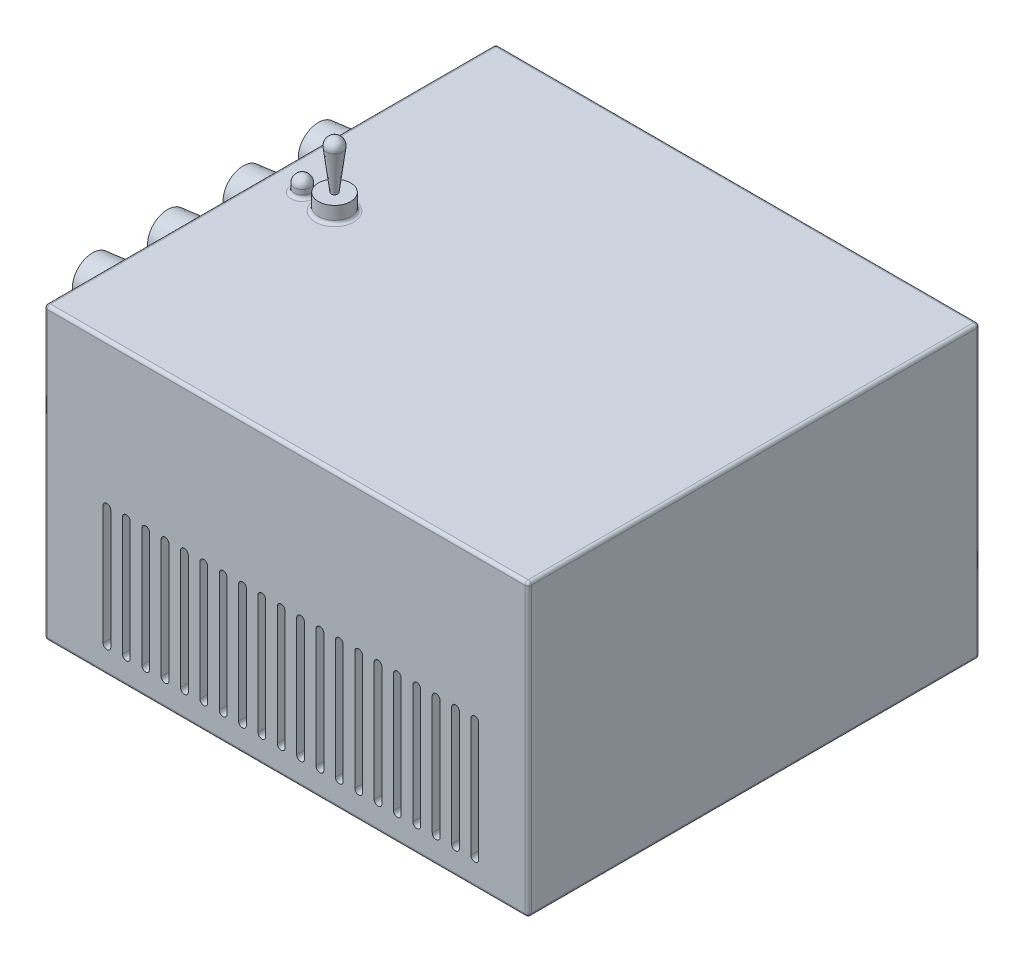
from build123d import *
from OCP.BRepFilletAPI import BRepFilletAPI_MakeChamfer

# Parameters (mm, degrees)
SKETCH1_W           = 150
SKETCH1_H           = 90
BOSS_EXTRUDE1_DEPTH = 140
SKETCH2_R           = 7.5
BOSS_EXTRUDE2_DEPTH = 20
CHAMFER1_SIZE       = 12
CHAMFER1_SIZE2      = 1.261250823
SKETCH3_R           = 4
CUT_EXTRUDE1_DEPTH  = 20
SKETCH4_R           = 2.5
BOSS_EXTRUDE3_DEPTH = 5
FILLET4_R           = 2.5
SKETCH5_R           = 5
BOSS_EXTRUDE4_DEPTH = 5
FILLET5_R           = 1
CUT_EXTRUDE2_DEPTH  = 182.245689604


with BuildPart() as part:
    # Sketch1 → Boss-Extrude1 (new body)
    with BuildSketch(Plane.XY):
        Rectangle(SKETCH1_W, SKETCH1_H)
    extrude(amount=BOSS_EXTRUDE1_DEPTH)

    # Sketch2 → Boss-Extrude2 (add)
    with BuildSketch(Plane.ZY.offset(75)):
        with Locations(Location((35, 25, 0), (0, 0, 180))):
            Circle(SKETCH2_R)
        with Locations(Location((105, 25, 0), (0, 0, 180))):
            Circle(SKETCH2_R)
        with Locations(Location((58.3, 25, 0), (0, 0, 180))):
            Circle(SKETCH2_R)
        with Locations(Location((81.7, 25, 0), (0, 0, 180))):
            Circle(SKETCH2_R)
    extrude(amount=BOSS_EXTRUDE2_DEPTH)

    # Chamfer1: one chamfer whose edges measure the first distance from different faces: ONE call of the kernel's chamfer builder (chamfer() names one face for all edges)
    chamfer1_edges_1 = [part.edges().sort_by_distance(p)[0] for p in [
        (-95, 25, 42.5),
    ]]
    chamfer1_side_1 = [part.faces().sort_by_distance(p)[0] for p in [
        (-85, 25, 42.5),
    ]]
    chamfer1_edges_2 = [part.edges().sort_by_distance(p)[0] for p in [
        (-95, 25, 112.5),
    ]]
    chamfer1_side_2 = [part.faces().sort_by_distance(p)[0] for p in [
        (-85, 25, 112.5),
    ]]
    chamfer1_edges_3 = [part.edges().sort_by_distance(p)[0] for p in [
        (-95, 25, 65.8),
    ]]
    chamfer1_side_3 = [part.faces().sort_by_distance(p)[0] for p in [
        (-85, 25, 65.8),
    ]]
    chamfer1_edges_4 = [part.edges().sort_by_distance(p)[0] for p in [
        (-95, 25, 89.2),
    ]]
    chamfer1_side_4 = [part.faces().sort_by_distance(p)[0] for p in [
        (-85, 25, 89.2),
    ]]
    chamfer1 = BRepFilletAPI_MakeChamfer(part.part.solid().wrapped)
    for e in chamfer1_edges_1:
        chamfer1.Add(CHAMFER1_SIZE, CHAMFER1_SIZE2, e.wrapped, chamfer1_side_1[0].wrapped)  # the first distance lies on this face
    for e in chamfer1_edges_2:
        chamfer1.Add(CHAMFER1_SIZE, CHAMFER1_SIZE2, e.wrapped, chamfer1_side_2[0].wrapped)  # the first distance lies on this face
    for e in chamfer1_edges_3:
        chamfer1.Add(CHAMFER1_SIZE, CHAMFER1_SIZE2, e.wrapped, chamfer1_side_3[0].wrapped)  # the first distance lies on this face
    for e in chamfer1_edges_4:
        chamfer1.Add(CHAMFER1_SIZE, CHAMFER1_SIZE2, e.wrapped, chamfer1_side_4[0].wrapped)  # the first distance lies on this face
    add(Compound.cast(chamfer1.Shape()), mode=Mode.REPLACE)

    # Sketch3 → Cut-Extrude1 (cut)
    with BuildSketch(Plane.ZY.offset(95)):
        with Locations((35, 25)):
            Circle(SKETCH3_R)
        with Locations((58.3, 25)):
            Circle(SKETCH3_R)
        with Locations((81.7, 25)):
            Circle(SKETCH3_R)
        with Locations((105, 25)):
            Circle(SKETCH3_R)
    extrude(amount=-CUT_EXTRUDE1_DEPTH, mode=Mode.SUBTRACT)

    # Sketch4 → Boss-Extrude3 (add)
    with BuildSketch(Plane(origin=(0, 45, 0), x_dir=(1, 0, 0), z_dir=(0, 1, 0))):
        with Locations((-65, -70)):
            Circle(SKETCH4_R)
    extrude(amount=BOSS_EXTRUDE3_DEPTH)

    # Fillet4
    fillet4_edges = [part.edges().sort_by_distance(p)[0] for p in [
        (-67.5, 50, 70),
    ]]
    fillet(fillet4_edges, radius=FILLET4_R)

    # Sketch5 → Boss-Extrude4 (add)
    with BuildSketch(Plane(origin=(0, 45, 0), x_dir=(1, 0, 0), z_dir=(0, 1, 0))):
        with Locations((-55, -70)):
            Circle(SKETCH5_R)
    extrude(amount=BOSS_EXTRUDE4_DEPTH)

    # Sketch8 → Revolve6 (revolve)
    with BuildSketch(Plane(origin=(0, 0, 70), x_dir=(-1, 0, 0), z_dir=(0, 0, -1)), mode=Mode.PRIVATE) as revolve6_sk:
        with BuildLine():
            Line((54, 50), (52.5, 62))
            ThreePointArc((52.5, 62), (53.047437581, 64.085468682), (55, 65))
            Line((55, 65), (55, 50))
            Line((55, 50), (54, 50))
        make_face()
    revolve(revolve6_sk.sketch.rotate(Axis((-55, 50, 70), (0, 1, 0)), 90), axis=Axis((-55, 50, 70), (0, 1, 0)))

    # Fillet5
    fillet5_edges = [part.edges().sort_by_distance(p)[0] for p in [
        (75, 0, 140),
        (0, 45, 140),
        (-75, 25, 42.5),
        (-75, 25, 112.5),
        (-75, 25, 65.8),
        (-75, 25, 89.2),
        (-75, 0, 140),
        (0, 45, 0),
        (75, 0, 0),
        (0, -45, 0),
        (-75, 0, 0),
        (-67.5, 45, 70),
        (-60, 45, 70),
        (0, -45, 140),
        (-75, 45, 70),
        (75, 45, 70),
        (75, -45, 70),
        (-75, -45, 70),
    ]]
    fillet(fillet5_edges, radius=FILLET5_R)

    # Sketch9 → Cut-Extrude2 (cut, through all)
    with BuildSketch(Plane.XY.offset(140)):
        with BuildLine():
            Line((-54.322706543, 0), (-54.322706543, -36.818354434))
            ThreePointArc((-54.322706543, -36.818354434), (-55.520617531, -38.016265422), (-56.718528519, -36.818354434))
            Line((-56.718528519, -36.818354434), (-56.718528519, 0))
            ThreePointArc((-56.718528519, 0), (-55.520617531, 1.197910988), (-54.322706543, 0))
        make_face()
        with BuildLine():
            Line((-48.322706543, 0), (-48.322706543, -36.818354434))
            ThreePointArc((-48.322706543, -36.818354434), (-49.520617531, -38.016265422), (-50.718528519, -36.818354434))
            Line((-50.718528519, -36.818354434), (-50.718528519, 0))
            ThreePointArc((-50.718528519, 0), (-49.520617531, 1.197910988), (-48.322706543, 0))
        make_face()
        with BuildLine():
            Line((-42.322706543, 0), (-42.322706543, -36.818354434))
            ThreePointArc((-42.322706543, -36.818354434), (-43.520617531, -38.016265422), (-44.718528519, -36.818354434))
            Line((-44.718528519, -36.818354434), (-44.718528519, 0))
            ThreePointArc((-44.718528519, 0), (-43.520617531, 1.197910988), (-42.322706543, 0))
        make_face()
        with BuildLine():
            Line((-36.322706543, 0), (-36.322706543, -36.818354434))
            ThreePointArc((-36.322706543, -36.818354434), (-37.520617531, -38.016265422), (-38.718528519, -36.818354434))
            Line((-38.718528519, -36.818354434), (-38.718528519, 0))
            ThreePointArc((-38.718528519, 0), (-37.520617531, 1.197910988), (-36.322706543, 0))
        make_face()
        with BuildLine():
            Line((-30.322706543, 0), (-30.322706543, -36.818354434))
            ThreePointArc((-30.322706543, -36.818354434), (-31.520617531, -38.016265422), (-32.718528519, -36.818354434))
            Line((-32.718528519, -36.818354434), (-32.718528519, 0))
            ThreePointArc((-32.718528519, 0), (-31.520617531, 1.197910988), (-30.322706543, 0))
        make_face()
        with BuildLine():
            Line((-24.322706543, 0), (-24.322706543, -36.818354434))
            ThreePointArc((-24.322706543, -36.818354434), (-25.520617531, -38.016265422), (-26.718528519, -36.818354434))
            Line((-26.718528519, -36.818354434), (-26.718528519, 0))
            ThreePointArc((-26.718528519, 0), (-25.520617531, 1.197910988), (-24.322706543, 0))
        make_face()
        with BuildLine():
            Line((-18.322706543, 0), (-18.322706543, -36.818354434))
            ThreePointArc((-18.322706543, -36.818354434), (-19.520617531, -38.016265422), (-20.718528519, -36.818354434))
            Line((-20.718528519, -36.818354434), (-20.718528519, 0))
            ThreePointArc((-20.718528519, 0), (-19.520617531, 1.197910988), (-18.322706543, 0))
        make_face()
        with BuildLine():
            Line((-12.322706543, 0), (-12.322706543, -36.818354434))
            ThreePointArc((-12.322706543, -36.818354434), (-13.520617531, -38.016265422), (-14.718528519, -36.818354434))
            Line((-14.718528519, -36.818354434), (-14.718528519, 0))
            ThreePointArc((-14.718528519, 0), (-13.520617531, 1.197910988), (-12.322706543, 0))
        make_face()
        with BuildLine():
            Line((-6.322706543, 0), (-6.322706543, -36.818354434))
            ThreePointArc((-6.322706543, -36.818354434), (-7.520617531, -38.016265422), (-8.718528519, -36.818354434))
            Line((-8.718528519, -36.818354434), (-8.718528519, 0))
            ThreePointArc((-8.718528519, 0), (-7.520617531, 1.197910988), (-6.322706543, 0))
        make_face()
        with BuildLine():
            Line((-0.322706543, 0), (-0.322706543, -36.818354434))
            ThreePointArc((-0.322706543, -36.818354434), (-1.520617531, -38.016265422), (-2.718528519, -36.818354434))
            Line((-2.718528519, -36.818354434), (-2.718528519, 0))
            ThreePointArc((-2.718528519, 0), (-1.520617531, 1.197910988), (-0.322706543, 0))
        make_face()
        with BuildLine():
            Line((5.677293457, 0), (5.677293457, -36.818354434))
            ThreePointArc((5.677293457, -36.818354434), (4.479382469, -38.016265422), (3.281471481, -36.818354434))
            Line((3.281471481, -36.818354434), (3.281471481, 0))
            ThreePointArc((3.281471481, 0), (4.479382469, 1.197910988), (5.677293457, 0))
        make_face()
        with BuildLine():
            Line((11.677293457, 0), (11.677293457, -36.818354434))
            ThreePointArc((11.677293457, -36.818354434), (10.479382469, -38.016265422), (9.281471481, -36.818354434))
            Line((9.281471481, -36.818354434), (9.281471481, 0))
            ThreePointArc((9.281471481, 0), (10.479382469, 1.197910988), (11.677293457, 0))
        make_face()
        with BuildLine():
            Line((17.677293457, 0), (17.677293457, -36.818354434))
            ThreePointArc((17.677293457, -36.818354434), (16.479382469, -38.016265422), (15.281471481, -36.818354434))
            Line((15.281471481, -36.818354434), (15.281471481, 0))
            ThreePointArc((15.281471481, 0), (16.479382469, 1.197910988), (17.677293457, 0))
        make_face()
        with BuildLine():
            Line((23.677293457, 0), (23.677293457, -36.818354434))
            ThreePointArc((23.677293457, -36.818354434), (22.479382469, -38.016265422), (21.281471481, -36.818354434))
            Line((21.281471481, -36.818354434), (21.281471481, 0))
            ThreePointArc((21.281471481, 0), (22.479382469, 1.197910988), (23.677293457, 0))
        make_face()
        with BuildLine():
            Line((29.677293457, 0), (29.677293457, -36.818354434))
            ThreePointArc((29.677293457, -36.818354434), (28.479382469, -38.016265422), (27.281471481, -36.818354434))
            Line((27.281471481, -36.818354434), (27.281471481, 0))
            ThreePointArc((27.281471481, 0), (28.479382469, 1.197910988), (29.677293457, 0))
        make_face()
        with BuildLine():
            Line((35.677293457, 0), (35.677293457, -36.818354434))
            ThreePointArc((35.677293457, -36.818354434), (34.479382469, -38.016265422), (33.281471481, -36.818354434))
            Line((33.281471481, -36.818354434), (33.281471481, 0))
            ThreePointArc((33.281471481, 0), (34.479382469, 1.197910988), (35.677293457, 0))
        make_face()
        with BuildLine():
            Line((41.677293457, 0), (41.677293457, -36.818354434))
            ThreePointArc((41.677293457, -36.818354434), (40.479382469, -38.016265422), (39.281471481, -36.818354434))
            Line((39.281471481, -36.818354434), (39.281471481, 0))
            ThreePointArc((39.281471481, 0), (40.479382469, 1.197910988), (41.677293457, 0))
        make_face()
        with BuildLine():
            Line((47.677293457, 0), (47.677293457, -36.818354434))
            ThreePointArc((47.677293457, -36.818354434), (46.479382469, -38.016265422), (45.281471481, -36.818354434))
            Line((45.281471481, -36.818354434), (45.281471481, 0))
            ThreePointArc((45.281471481, 0), (46.479382469, 1.197910988), (47.677293457, 0))
        make_face()
        with BuildLine():
            Line((53.677293457, 0), (53.677293457, -36.818354434))
            ThreePointArc((53.677293457, -36.818354434), (52.479382469, -38.016265422), (51.281471481, -36.818354434))
            Line((51.281471481, -36.818354434), (51.281471481, 0))
            ThreePointArc((51.281471481, 0), (52.479382469, 1.197910988), (53.677293457, 0))
        make_face()
        with BuildLine():
            Line((59.677293457, 0), (59.677293457, -36.818354434))
            ThreePointArc((59.677293457, -36.818354434), (58.479382469, -38.016265422), (57.281471481, -36.818354434))
            Line((57.281471481, -36.818354434), (57.281471481, 0))
            ThreePointArc((57.281471481, 0), (58.479382469, 1.197910988), (59.677293457, 0))
        make_face()
    extrude(amount=-CUT_EXTRUDE2_DEPTH, mode=Mode.SUBTRACT)


solid = part.part
